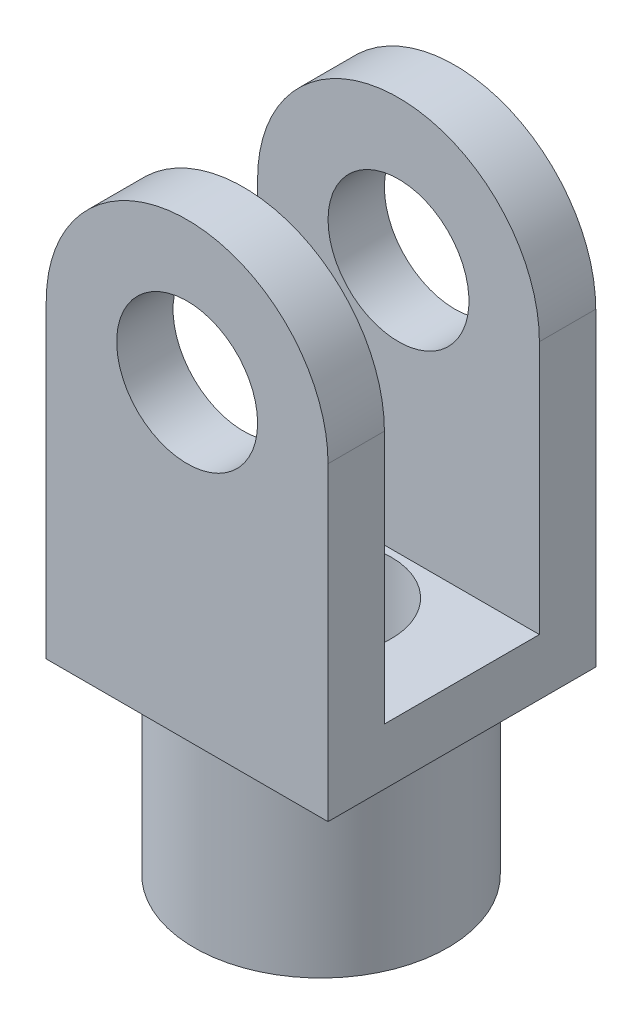
from build123d import *

# Parameters (mm, degrees)
ESQUISSE1_R             = 10
ESQUISSE1_R_2           = 5
BOSS_EXTRU_1_DEPTH      = 19
ENL_V_START             = -4
ESQUISSE2_W             = 20
ESQUISSE2_H             = 11
ENL_V_MAT_EXTRU_1_DEPTH = 39.249260349
ESQUISSE3_R             = 5
ENL_V_MAT_EXTRU_2_DEPTH = 43.249260349
BOSS_EXTRU_2_START      = 13
ESQUISSE4_R             = 9
ESQUISSE4_R_2           = 5
BOSS_EXTRU_2_DEPTH      = 13


with BuildPart() as part:
    # Esquisse1 → Boss.-Extru.1 (new body)
    # profile 1 of 2: a face of its own
    with BuildSketch(Plane.XY):
        with BuildLine():
            Line((0, 22), (0, 0))
            Line((0, 0), (20, 0))
            Line((20, 0), (20, 22))
            ThreePointArc((20, 22), (10, 12), (0, 22))
        make_face()
    # profile 2 of 2: a face of its own
    with BuildSketch(Plane.XY):
        with Locations((10, 22)):
            Circle(ESQUISSE1_R)
        with Locations((10, 22)):
            Circle(ESQUISSE1_R_2, mode=Mode.SUBTRACT)
    extrude(amount=BOSS_EXTRU_1_DEPTH)

    # Esquisse2 → Enlèv. mat.-Extru.1 (cut, through all)
    with BuildSketch(Plane.XZ.offset(ENL_V_START)):
        with Locations((10, 9.5)):
            Rectangle(ESQUISSE2_W, ESQUISSE2_H)
    extrude(amount=-ENL_V_MAT_EXTRU_1_DEPTH, mode=Mode.SUBTRACT)

    # Esquisse3 → Enlèv. mat.-Extru.2 (cut, through all)
    with BuildSketch(Plane.XZ):
        with Locations(Location((10, 9.5, 0), (0, 0, 270))):
            Circle(ESQUISSE3_R)
    extrude(amount=-ENL_V_MAT_EXTRU_2_DEPTH, mode=Mode.SUBTRACT)

    # Esquisse4 → Boss.-Extru.2 (add)
    with BuildSketch(Plane.XZ.offset(BOSS_EXTRU_2_START)):
        with Locations(Location((10, 9.5, 0), (0, 0, 270))):
            Circle(ESQUISSE4_R)
        with Locations(Location((10, 9.5, 0), (0, 0, 270))):
            Circle(ESQUISSE4_R_2, mode=Mode.SUBTRACT)
    extrude(amount=-BOSS_EXTRU_2_DEPTH)


solid = part.part
